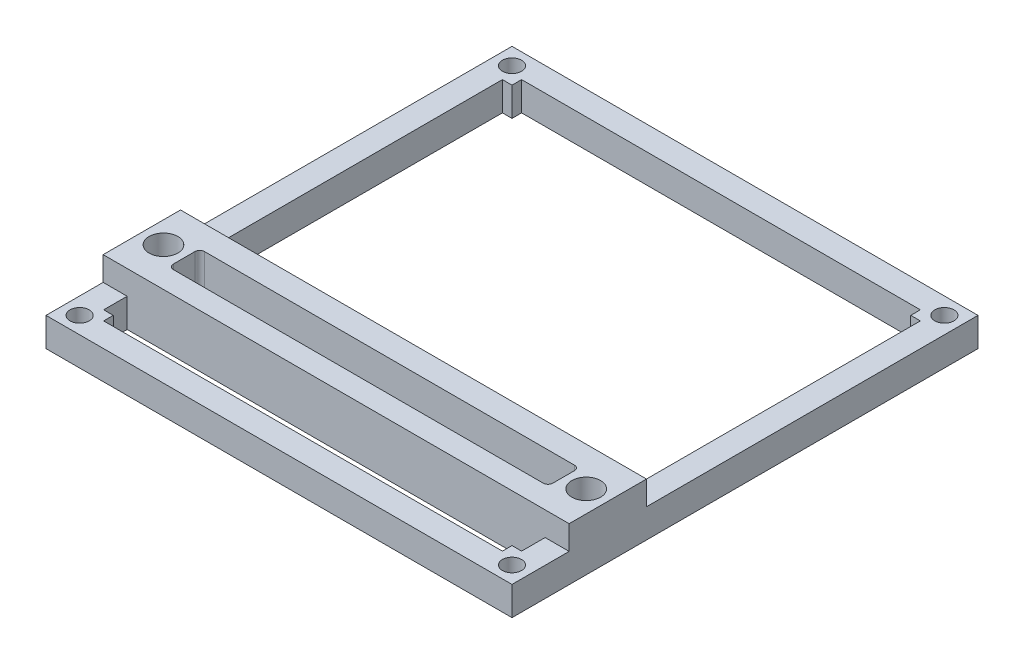
from build123d import *

# Parameters (mm, degrees)
BOSS_EXTRUDE1_DEPTH = 6
SKETCH6_W           = 87
SKETCH6_H           = 6.5
BOSS_EXTRUDE2_DEPTH = 2
SKETCH7_W           = 97
SKETCH7_H           = 16.106562898
SKETCH7_W_2         = 87
SKETCH7_H_2         = 6.5
BOSS_EXTRUDE3_DEPTH = 5
SKETCH8_R           = 2
CUT_EXTRUDE1_DEPTH  = 138.309868546
SKETCH10_W          = 4
SKETCH10_H          = 6.5
BOSS_EXTRUDE4_DEPTH = 9
SKETCH11_R          = 3
CUT_EXTRUDE2_DEPTH  = 21
FILLET1_R           = 1


with BuildPart() as part:
    # Sketch1 → Boss-Extrude1 (new body)
    with BuildSketch(Plane(origin=(0, 0, 0), x_dir=(1, 0, 0), z_dir=(0, 1, 0))):
        Polygon((0, 7), (0, 0), (7, 0), (90, 0), (97, 0), (97, 7), (97, 90), (97, 97), (90, 97), (7, 97), (0, 97), (0, 90), align=None)
        Polygon((7, 7), (5, 7), (5, 11.893437102), (92, 11.893437102), (92, 7), (90, 7), (90, 5), (7, 5), align=None, mode=Mode.SUBTRACT)
        Polygon((5, 23), (92, 23), (92, 16.5), (5, 16.5), (5, 16.893437102), align=None, mode=Mode.SUBTRACT)
        Polygon((7, 92), (90, 92), (90, 90), (92, 90), (92, 28), (5, 28), (5, 90), (7, 90), align=None, mode=Mode.SUBTRACT)
    extrude(amount=BOSS_EXTRUDE1_DEPTH)

    # Sketch6 → Boss-Extrude2 (add)
    with BuildSketch(Plane.XZ):
        with Locations((48.5, -19.75)):
            Rectangle(SKETCH6_W, SKETCH6_H)
    extrude(amount=-BOSS_EXTRUDE2_DEPTH)

    # Sketch7 → Boss-Extrude3 (add)
    with BuildSketch(Plane(origin=(0, 6, 0), x_dir=(1, 0, 0), z_dir=(0, 1, 0))):
        with Locations((48.5, 19.946718551)):
            Rectangle(SKETCH7_W, SKETCH7_H)
        with Locations((48.5, 19.75)):
            Rectangle(SKETCH7_W_2, SKETCH7_H_2, mode=Mode.SUBTRACT)
    extrude(amount=BOSS_EXTRUDE3_DEPTH)

    # Sketch8 → Cut-Extrude1 (cut, through all)
    with BuildSketch(Plane(origin=(0, 6, 0), x_dir=(1, 0, 0), z_dir=(0, 1, 0))):
        with Locations(Location((93.5, 93.5, 0), (0, 0, 270))):
            Circle(SKETCH8_R)
        with Locations(Location((3.5, 3.5, 0), (0, 0, 270))):
            Circle(SKETCH8_R)
        with Locations(Location((3.5, 93.5, 0), (0, 0, 270))):
            Circle(SKETCH8_R)
        with Locations(Location((93.5, 3.5, 0), (0, 0, 270))):
            Circle(SKETCH8_R)
    extrude(amount=-CUT_EXTRUDE1_DEPTH, mode=Mode.SUBTRACT)

    # Sketch10 → Boss-Extrude4 (add)
    with BuildSketch(Plane(origin=(0, 2, 0), x_dir=(1, 0, 0), z_dir=(0, 1, 0))):
        with Locations((90, 19.75)):
            Rectangle(SKETCH10_W, SKETCH10_H)
        with Locations((7, 19.75)):
            Rectangle(SKETCH10_W, SKETCH10_H)
    extrude(amount=BOSS_EXTRUDE4_DEPTH)

    # Sketch11 → Cut-Extrude2 (cut)
    with BuildSketch(Plane(origin=(0, 11, 0), x_dir=(1, 0, 0), z_dir=(0, 1, 0))):
        with Locations(Location((92.5, 19.946718551, 0), (0, 0, 270))):
            Circle(SKETCH11_R)
        with Locations(Location((4.5, 19.946718551, 0), (0, 0, 270))):
            Circle(SKETCH11_R)
    extrude(amount=-CUT_EXTRUDE2_DEPTH, mode=Mode.SUBTRACT)

    # Fillet1
    fillet1_edges = [part.edges().sort_by_distance(p)[0] for p in [
        (88, 6.5, -23),
        (88, 6.5, -16.5),
        (9, 6.5, -16.5),
        (9, 6.5, -23),
    ]]
    fillet(fillet1_edges, radius=FILLET1_R)


solid = part.part
